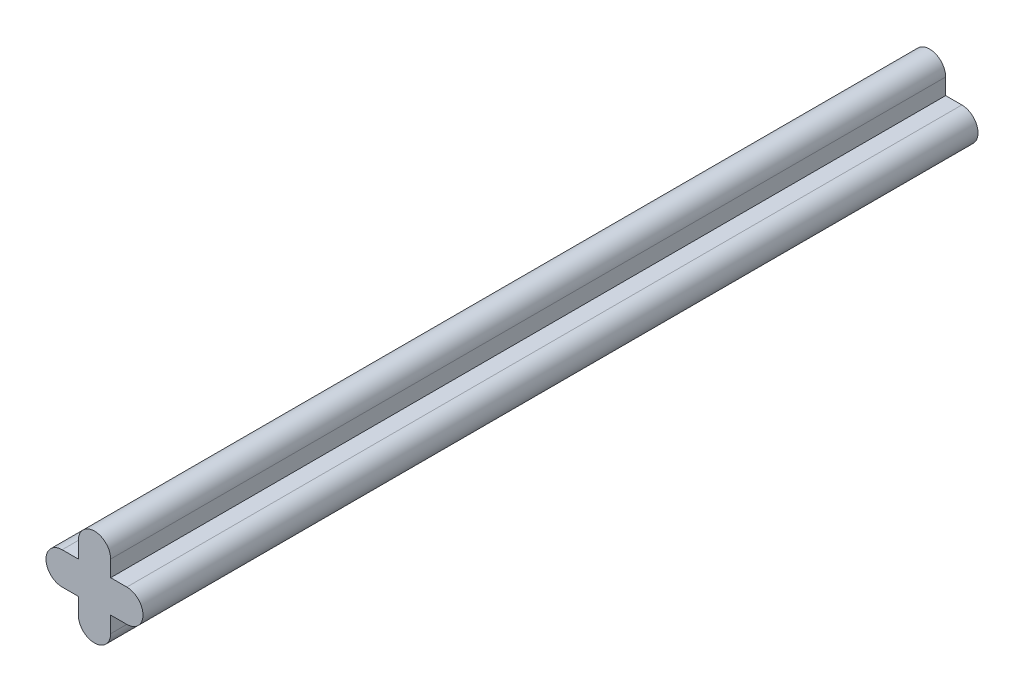
from build123d import *

# Parameters (mm, degrees)
BOSS_EXTRUDE1_DEPTH = 39.37


with BuildPart() as part:
    # Sketch1 → Boss-Extrude1 (new body)
    with BuildSketch(Plane.XY):
        with BuildLine():
            Line((0.762, 0.762), (0, 0.762))
            ThreePointArc((0, 0.762), (-0.762, 0), (0, -0.762))
            Line((0, -0.762), (0.762, -0.762))
            Line((0.762, -0.762), (0.762, -1.524))
            ThreePointArc((0.762, -1.524), (1.524, -2.286), (2.286, -1.524))
            Line((2.286, -1.524), (2.286, -0.762))
            Line((2.286, -0.762), (3.048, -0.762))
            ThreePointArc((3.048, -0.762), (3.81, 0), (3.048, 0.762))
            Line((3.048, 0.762), (2.286, 0.762))
            Line((2.286, 0.762), (2.286, 1.524))
            ThreePointArc((2.286, 1.524), (1.524, 2.286), (0.762, 1.524))
            Line((0.762, 1.524), (0.762, 0.762))
        make_face()
    extrude(amount=BOSS_EXTRUDE1_DEPTH)


solid = part.part
